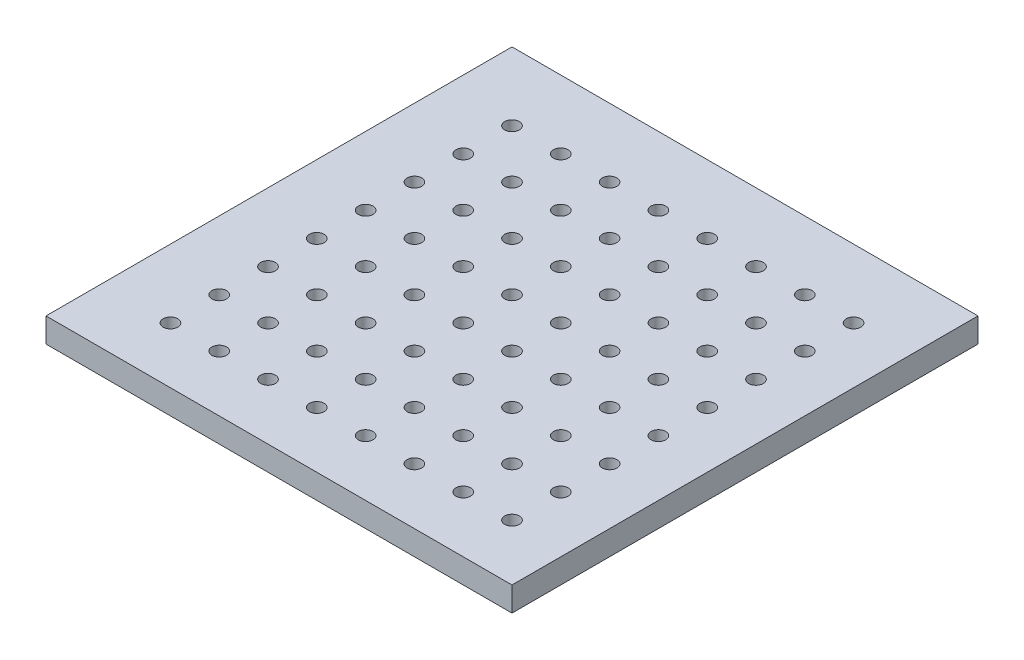
from build123d import *

# Parameters (mm, degrees)
SKETCH1_W           = 191
SKETCH1_H           = 191
SKETCH1_R           = 3
BOSS_EXTRUDE1_DEPTH = 10


with BuildPart() as part:
    # Sketch1 → Boss-Extrude1 (new body)
    with BuildSketch(Plane(origin=(0, 0, 0), x_dir=(1, 0, 0), z_dir=(0, 1, 0))):
        with Locations((95.5, 95.5)):
            Rectangle(SKETCH1_W, SKETCH1_H)
        with Locations(Location((28, 163, 0), (0, 0, 270))):
            Circle(SKETCH1_R, mode=Mode.SUBTRACT)
        with Locations(Location((48, 163, 0), (0, 0, 270))):
            Circle(SKETCH1_R, mode=Mode.SUBTRACT)
        with Locations(Location((68, 163, 0), (0, 0, 270))):
            Circle(SKETCH1_R, mode=Mode.SUBTRACT)
        with Locations(Location((88, 163, 0), (0, 0, 270))):
            Circle(SKETCH1_R, mode=Mode.SUBTRACT)
        with Locations(Location((108, 163, 0), (0, 0, 270))):
            Circle(SKETCH1_R, mode=Mode.SUBTRACT)
        with Locations(Location((48, 143, 0), (0, 0, 270))):
            Circle(SKETCH1_R, mode=Mode.SUBTRACT)
        with Locations(Location((68, 143, 0), (0, 0, 270))):
            Circle(SKETCH1_R, mode=Mode.SUBTRACT)
        with Locations(Location((88, 143, 0), (0, 0, 270))):
            Circle(SKETCH1_R, mode=Mode.SUBTRACT)
        with Locations(Location((108, 143, 0), (0, 0, 270))):
            Circle(SKETCH1_R, mode=Mode.SUBTRACT)
        with Locations(Location((48, 123, 0), (0, 0, 270))):
            Circle(SKETCH1_R, mode=Mode.SUBTRACT)
        with Locations(Location((68, 123, 0), (0, 0, 270))):
            Circle(SKETCH1_R, mode=Mode.SUBTRACT)
        with Locations(Location((88, 123, 0), (0, 0, 270))):
            Circle(SKETCH1_R, mode=Mode.SUBTRACT)
        with Locations(Location((108, 123, 0), (0, 0, 270))):
            Circle(SKETCH1_R, mode=Mode.SUBTRACT)
        with Locations(Location((48, 103, 0), (0, 0, 270))):
            Circle(SKETCH1_R, mode=Mode.SUBTRACT)
        with Locations(Location((68, 103, 0), (0, 0, 270))):
            Circle(SKETCH1_R, mode=Mode.SUBTRACT)
        with Locations(Location((88, 103, 0), (0, 0, 270))):
            Circle(SKETCH1_R, mode=Mode.SUBTRACT)
        with Locations(Location((108, 103, 0), (0, 0, 270))):
            Circle(SKETCH1_R, mode=Mode.SUBTRACT)
        with Locations(Location((48, 83, 0), (0, 0, 270))):
            Circle(SKETCH1_R, mode=Mode.SUBTRACT)
        with Locations(Location((68, 83, 0), (0, 0, 270))):
            Circle(SKETCH1_R, mode=Mode.SUBTRACT)
        with Locations(Location((88, 83, 0), (0, 0, 270))):
            Circle(SKETCH1_R, mode=Mode.SUBTRACT)
        with Locations(Location((108, 83, 0), (0, 0, 270))):
            Circle(SKETCH1_R, mode=Mode.SUBTRACT)
        with Locations(Location((28, 143, 0), (0, 0, 270))):
            Circle(SKETCH1_R, mode=Mode.SUBTRACT)
        with Locations(Location((28, 123, 0), (0, 0, 270))):
            Circle(SKETCH1_R, mode=Mode.SUBTRACT)
        with Locations(Location((28, 103, 0), (0, 0, 270))):
            Circle(SKETCH1_R, mode=Mode.SUBTRACT)
        with Locations(Location((28, 83, 0), (0, 0, 270))):
            Circle(SKETCH1_R, mode=Mode.SUBTRACT)
        with Locations(Location((28, 63, 0), (0, 0, 270))):
            Circle(SKETCH1_R, mode=Mode.SUBTRACT)
        with Locations(Location((48, 63, 0), (0, 0, 270))):
            Circle(SKETCH1_R, mode=Mode.SUBTRACT)
        with Locations(Location((68, 63, 0), (0, 0, 270))):
            Circle(SKETCH1_R, mode=Mode.SUBTRACT)
        with Locations(Location((88, 63, 0), (0, 0, 270))):
            Circle(SKETCH1_R, mode=Mode.SUBTRACT)
        with Locations(Location((108, 63, 0), (0, 0, 270))):
            Circle(SKETCH1_R, mode=Mode.SUBTRACT)
        with Locations(Location((28, 43, 0), (0, 0, 270))):
            Circle(SKETCH1_R, mode=Mode.SUBTRACT)
        with Locations(Location((48, 43, 0), (0, 0, 270))):
            Circle(SKETCH1_R, mode=Mode.SUBTRACT)
        with Locations(Location((68, 43, 0), (0, 0, 270))):
            Circle(SKETCH1_R, mode=Mode.SUBTRACT)
        with Locations(Location((88, 43, 0), (0, 0, 270))):
            Circle(SKETCH1_R, mode=Mode.SUBTRACT)
        with Locations(Location((108, 43, 0), (0, 0, 270))):
            Circle(SKETCH1_R, mode=Mode.SUBTRACT)
        with Locations(Location((28, 23, 0), (0, 0, 270))):
            Circle(SKETCH1_R, mode=Mode.SUBTRACT)
        with Locations(Location((48, 23, 0), (0, 0, 270))):
            Circle(SKETCH1_R, mode=Mode.SUBTRACT)
        with Locations(Location((68, 23, 0), (0, 0, 270))):
            Circle(SKETCH1_R, mode=Mode.SUBTRACT)
        with Locations(Location((88, 23, 0), (0, 0, 270))):
            Circle(SKETCH1_R, mode=Mode.SUBTRACT)
        with Locations(Location((108, 23, 0), (0, 0, 270))):
            Circle(SKETCH1_R, mode=Mode.SUBTRACT)
        with Locations(Location((128, 163, 0), (0, 0, 270))):
            Circle(SKETCH1_R, mode=Mode.SUBTRACT)
        with Locations(Location((148, 163, 0), (0, 0, 270))):
            Circle(SKETCH1_R, mode=Mode.SUBTRACT)
        with Locations(Location((168, 163, 0), (0, 0, 270))):
            Circle(SKETCH1_R, mode=Mode.SUBTRACT)
        with Locations(Location((128, 143, 0), (0, 0, 270))):
            Circle(SKETCH1_R, mode=Mode.SUBTRACT)
        with Locations(Location((148, 143, 0), (0, 0, 270))):
            Circle(SKETCH1_R, mode=Mode.SUBTRACT)
        with Locations(Location((168, 143, 0), (0, 0, 270))):
            Circle(SKETCH1_R, mode=Mode.SUBTRACT)
        with Locations(Location((128, 123, 0), (0, 0, 270))):
            Circle(SKETCH1_R, mode=Mode.SUBTRACT)
        with Locations(Location((148, 123, 0), (0, 0, 270))):
            Circle(SKETCH1_R, mode=Mode.SUBTRACT)
        with Locations(Location((168, 123, 0), (0, 0, 270))):
            Circle(SKETCH1_R, mode=Mode.SUBTRACT)
        with Locations(Location((128, 103, 0), (0, 0, 270))):
            Circle(SKETCH1_R, mode=Mode.SUBTRACT)
        with Locations(Location((148, 103, 0), (0, 0, 270))):
            Circle(SKETCH1_R, mode=Mode.SUBTRACT)
        with Locations(Location((168, 103, 0), (0, 0, 270))):
            Circle(SKETCH1_R, mode=Mode.SUBTRACT)
        with Locations(Location((128, 83, 0), (0, 0, 270))):
            Circle(SKETCH1_R, mode=Mode.SUBTRACT)
        with Locations(Location((148, 83, 0), (0, 0, 270))):
            Circle(SKETCH1_R, mode=Mode.SUBTRACT)
        with Locations(Location((168, 83, 0), (0, 0, 270))):
            Circle(SKETCH1_R, mode=Mode.SUBTRACT)
        with Locations(Location((128, 63, 0), (0, 0, 270))):
            Circle(SKETCH1_R, mode=Mode.SUBTRACT)
        with Locations(Location((148, 63, 0), (0, 0, 270))):
            Circle(SKETCH1_R, mode=Mode.SUBTRACT)
        with Locations(Location((168, 63, 0), (0, 0, 270))):
            Circle(SKETCH1_R, mode=Mode.SUBTRACT)
        with Locations(Location((128, 43, 0), (0, 0, 270))):
            Circle(SKETCH1_R, mode=Mode.SUBTRACT)
        with Locations(Location((148, 43, 0), (0, 0, 270))):
            Circle(SKETCH1_R, mode=Mode.SUBTRACT)
        with Locations(Location((168, 43, 0), (0, 0, 270))):
            Circle(SKETCH1_R, mode=Mode.SUBTRACT)
        with Locations(Location((128, 23, 0), (0, 0, 270))):
            Circle(SKETCH1_R, mode=Mode.SUBTRACT)
        with Locations(Location((148, 23, 0), (0, 0, 270))):
            Circle(SKETCH1_R, mode=Mode.SUBTRACT)
        with Locations(Location((168, 23, 0), (0, 0, 270))):
            Circle(SKETCH1_R, mode=Mode.SUBTRACT)
    extrude(amount=BOSS_EXTRUDE1_DEPTH)


solid = part.part
